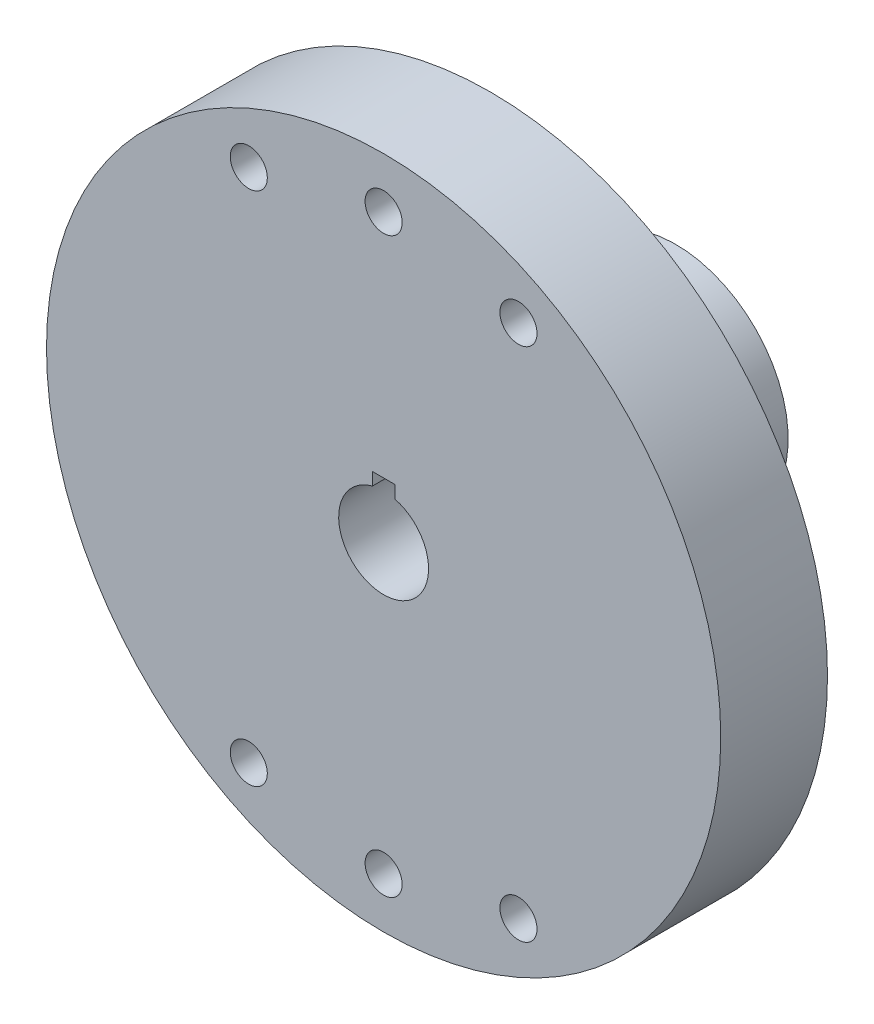
from build123d import *

# Parameters (mm, degrees)
SKETCH1_W                 = 30
SKETCH1_H                 = 9.5
CUT_EXTRUDE1_DEPTH        = 3.5
SKETCH3_R                 = 17.4
BOSS_EXTRUDE1_DEPTH       = 4
SKETCH4_R                 = 10
BOSS_EXTRUDE2_DEPTH       = 16
CUT_EXTRUDE2_DEPTH        = 50.759421218
SKETCH6_W                 = 4
SKETCH6_H                 = 26
M4X0_7_TAPPED_HOLE1_D     = 3.3
M3X0_5_TAPPED_HOLE1_D     = 2.5
M3X0_5_TAPPED_HOLE1_DEPTH = 7.5
M3X0_5_TAPPED_HOLE1_TIP   = 0.751075774
FILLET1_R                 = 2
SKETCH15_W                = 1.25
SKETCH15_H                = 30


with BuildPart() as part:
    # Sketch1 → Revolve1 (revolve)
    with BuildSketch(Plane.XZ, mode=Mode.PRIVATE) as revolve1_sk:
        with Locations((15, 5.25)):
            Rectangle(SKETCH1_W, SKETCH1_H)
    revolve(revolve1_sk.sketch.rotate(Axis((0, 0, 10), (0, 0, -1)), 180), axis=Axis((0, 0, 10), (0, 0, -1)))

    # Sketch2 → Cut-Extrude1 (cut)
    with BuildSketch(Plane(origin=(0, 0, 0.5), x_dir=(-1, 0, 0), z_dir=(0, 0, -1))):
        with BuildLine():
            ThreePointArc((-14.379253383, 22.852506912), (-27, 0), (-14.379253383, -22.852506912))
            ThreePointArc((-14.379253383, -22.852506912), (-13.103370267, -25.060195635), (-10.562335147, -24.848281153))
            ThreePointArc((-10.562335147, -24.848281153), (-6.318658968, -26.250229501), (-1.901854596, -26.932934283))
            ThreePointArc((-1.901854596, -26.932934283), (0, -27.88125), (1.901854596, -26.932934283))
            ThreePointArc((1.901854596, -26.932934283), (6.318658968, -26.250229501), (10.562335147, -24.848281153))
            ThreePointArc((10.562335147, -24.848281153), (13.103370267, -25.060195635), (14.379253383, -22.852506912))
            ThreePointArc((14.379253383, -22.852506912), (27, 0), (14.379253383, 22.852506912))
            ThreePointArc((14.379253383, 22.852506912), (13.103370267, 25.060195635), (10.562335147, 24.848281153))
            ThreePointArc((10.562335147, 24.848281153), (6.318658968, 26.250229501), (1.901854596, 26.932934283))
            ThreePointArc((1.901854596, 26.932934283), (0, 27.88125), (-1.901854596, 26.932934283))
            ThreePointArc((-1.901854596, 26.932934283), (-6.318658968, 26.250229501), (-10.562335147, 24.848281153))
            ThreePointArc((-10.562335147, 24.848281153), (-13.103370267, 25.060195635), (-14.379253383, 22.852506912))
        make_face()
    extrude(amount=-CUT_EXTRUDE1_DEPTH, mode=Mode.SUBTRACT)

    # Sketch3 → Boss-Extrude1 (add)
    with BuildSketch(Plane(origin=(0, 0, 4), x_dir=(-1, 0, 0), z_dir=(0, 0, -1))):
        Circle(SKETCH3_R)
    extrude(amount=BOSS_EXTRUDE1_DEPTH)

    # Sketch4 → Boss-Extrude2 (add)
    with BuildSketch(Plane(origin=(0, 0, 0), x_dir=(-1, 0, 0), z_dir=(0, 0, -1))):
        Circle(SKETCH4_R)
    extrude(amount=BOSS_EXTRUDE2_DEPTH)

    # Sketch5 → Cut-Extrude2 (cut, through all)
    with BuildSketch(Plane.XY.offset(10)):
        with BuildLine():
            Line((-1, 5), (-1, 3.872983346))
            ThreePointArc((-1, 3.872983346), (0, 4), (1, 3.872983346))
            Line((1, 3.872983346), (1, 5))
            Line((1, 5), (-1, 5))
        make_face()
    extrude(amount=-CUT_EXTRUDE2_DEPTH, mode=Mode.SUBTRACT)

    # Sketch6 → Cut-Revolve1 (revolve, cut)
    with BuildSketch(Plane.XZ):
        with Locations((2, -3)):
            Rectangle(SKETCH6_W, SKETCH6_H)
    revolve(axis=Axis((0, 0, 10), (0, 0, -1)), mode=Mode.SUBTRACT)

    # M4x0.7 Tapped Hole1 (through all)
    with Locations(Plane.XY.offset(10)):
        with Locations((-12, -22.95), (0, -25.5), (12, -22.95), (12, 22.95), (0, 25.5), (-12, 22.95)):
            Hole(M4X0_7_TAPPED_HOLE1_D / 2)

    # M3x0.5 Tapped Hole1
    with Locations(Plane(origin=(0, 0, -16), x_dir=(-1, 0, 0), z_dir=(0, 0, -1))):
        with Locations((-5.055813485, -5.055813485), (5.055813485, -5.055813485), (5.055813485, 5.055813485), (-5.055813485, 5.055813485)):
            Hole(M3X0_5_TAPPED_HOLE1_D / 2, depth=M3X0_5_TAPPED_HOLE1_DEPTH)
            with Locations((0, 0, -(M3X0_5_TAPPED_HOLE1_DEPTH + M3X0_5_TAPPED_HOLE1_TIP / 2))):  # 118° drill point
                Cone(0, M3X0_5_TAPPED_HOLE1_D / 2, M3X0_5_TAPPED_HOLE1_TIP, mode=Mode.SUBTRACT)

    # Fillet1
    fillet1_edges = [part.edges().sort_by_distance(p)[0] for p in [
        (10, 0, 0),
    ]]
    fillet(fillet1_edges, radius=FILLET1_R)

    # Sketch15 → M3x0.5 Tapped Hole2 (revolve, cut)
    with BuildSketch(Plane(origin=(0, 0, -8), x_dir=(0, 0, -1), z_dir=(1, 0, 0))):
        with Locations((0.625, 15)):
            Rectangle(SKETCH15_W, SKETCH15_H)
    revolve(axis=Axis((0, -6.35, -8), (0, 1, 0)), mode=Mode.SUBTRACT)


solid = part.part
